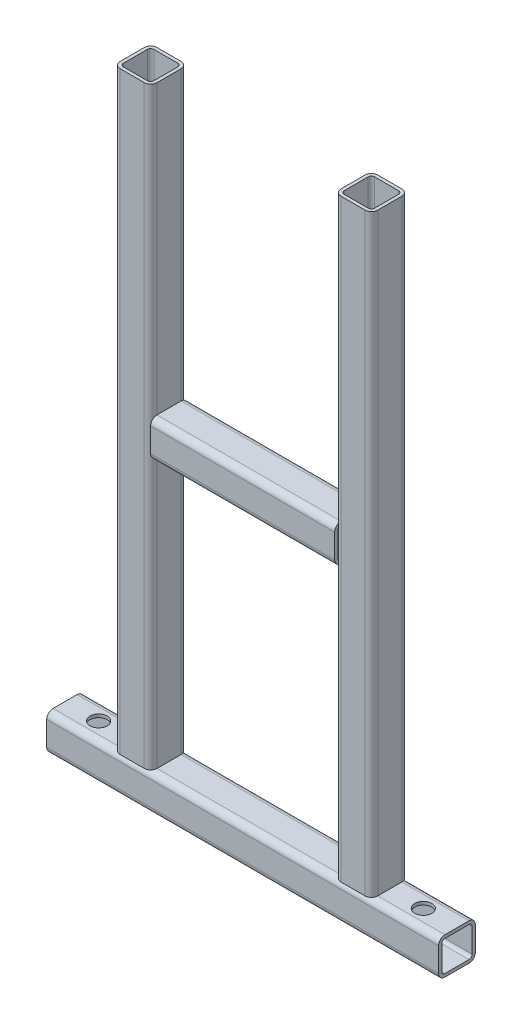
from build123d import *

# Parameters (mm, degrees)
SQUARE_TUBE_CONFIGURED_30_X_30_X_2_6_1_DEPTH = 501
SQUARE_TUBE_CONFIGURED_30_X_30_X_2_3_DEPTH   = 501
SQUARE_TUBE_CONFIGURED_30_X_30_X_2_4_DEPTH   = 320
SQUARE_TUBE_CONFIGURED_30_X_30_X_2_5_DEPTH   = 182.26
IZIM9_W                                      = 7
IZIM9_H                                      = 30


with BuildPart() as part:
    # Sketch1 → Square tube - configured 30 X 30 X 2.6(1) (new body)
    with BuildSketch(Plane(origin=(-90.13, 0, 0), x_dir=(1, 0, 0), z_dir=(0, -1, 0))):
        with BuildLine():
            Line((-9.8, -15), (9.8, -15))
            ThreePointArc((9.8, -15), (13.476955262, -13.476955262), (15, -9.8))
            Line((15, -9.8), (15, 9.8))
            ThreePointArc((15, 9.8), (13.476955262, 13.476955262), (9.8, 15))
            Line((9.8, 15), (-9.8, 15))
            ThreePointArc((-9.8, 15), (-13.476955262, 13.476955262), (-15, 9.8))
            Line((-15, 9.8), (-15, -9.8))
            ThreePointArc((-15, -9.8), (-13.476955262, -13.476955262), (-9.8, -15))
        make_face()
        with BuildLine():
            Line((-9.8, -12.4), (9.8, -12.4))
            ThreePointArc((9.8, -12.4), (11.638477631, -11.638477631), (12.4, -9.8))
            Line((12.4, -9.8), (12.4, 9.8))
            ThreePointArc((12.4, 9.8), (11.638477631, 11.638477631), (9.8, 12.4))
            Line((9.8, 12.4), (-9.8, 12.4))
            ThreePointArc((-9.8, 12.4), (-11.638477631, 11.638477631), (-12.4, 9.8))
            Line((-12.4, 9.8), (-12.4, -9.8))
            ThreePointArc((-12.4, -9.8), (-11.638477631, -11.638477631), (-9.8, -12.4))
        make_face(mode=Mode.SUBTRACT)
    extrude(amount=SQUARE_TUBE_CONFIGURED_30_X_30_X_2_6_1_DEPTH)

    # Square tube - configured 30 X 30 X 2 2
    split(bisect_by=Plane(origin=(-90.13, -485, 0), x_dir=(-1, 0, 0), z_dir=(0, 1, 0)), keep=Keep.TOP)


with BuildPart() as body_2:
    # Sketch1 on segment 2 (carried to segment 2) → Square tube - configured 30 X 30 X 2 3 (new body)
    with BuildSketch(Plane(origin=(90.13, 0, 0), x_dir=(1, 0, 0), z_dir=(0, -1, 0))):
        with BuildLine():
            Line((-9.8, -15), (9.8, -15))
            ThreePointArc((9.8, -15), (13.476955262, -13.476955262), (15, -9.8))
            Line((15, -9.8), (15, 9.8))
            ThreePointArc((15, 9.8), (13.476955262, 13.476955262), (9.8, 15))
            Line((9.8, 15), (-9.8, 15))
            ThreePointArc((-9.8, 15), (-13.476955262, 13.476955262), (-15, 9.8))
            Line((-15, 9.8), (-15, -9.8))
            ThreePointArc((-15, -9.8), (-13.476955262, -13.476955262), (-9.8, -15))
        make_face()
        with BuildLine():
            Line((-9.8, -12.4), (9.8, -12.4))
            ThreePointArc((9.8, -12.4), (11.638477631, -11.638477631), (12.4, -9.8))
            Line((12.4, -9.8), (12.4, 9.8))
            ThreePointArc((12.4, 9.8), (11.638477631, 11.638477631), (9.8, 12.4))
            Line((9.8, 12.4), (-9.8, 12.4))
            ThreePointArc((-9.8, 12.4), (-11.638477631, 11.638477631), (-12.4, 9.8))
            Line((-12.4, 9.8), (-12.4, -9.8))
            ThreePointArc((-12.4, -9.8), (-11.638477631, -11.638477631), (-9.8, -12.4))
        make_face(mode=Mode.SUBTRACT)
    extrude(amount=SQUARE_TUBE_CONFIGURED_30_X_30_X_2_3_DEPTH)

    # Square tube - configured 30 X 30 X 2 3 e
    split(bisect_by=Plane(origin=(90.13, -485, 0), x_dir=(-1, 0, 0), z_dir=(0, 1, 0)), keep=Keep.TOP)


with BuildPart() as body_3:
    # Sketch1 on segment 3 (carried to segment 3) → Square tube - configured 30 X 30 X 2 4 (new body)
    with BuildSketch(Plane(origin=(-160, -500, 0), x_dir=(0, 1, 0), z_dir=(1, 0, 0))):
        with BuildLine():
            Line((-9.8, -15), (9.8, -15))
            ThreePointArc((9.8, -15), (13.476955262, -13.476955262), (15, -9.8))
            Line((15, -9.8), (15, 9.8))
            ThreePointArc((15, 9.8), (13.476955262, 13.476955262), (9.8, 15))
            Line((9.8, 15), (-9.8, 15))
            ThreePointArc((-9.8, 15), (-13.476955262, 13.476955262), (-15, 9.8))
            Line((-15, 9.8), (-15, -9.8))
            ThreePointArc((-15, -9.8), (-13.476955262, -13.476955262), (-9.8, -15))
        make_face()
        with BuildLine():
            Line((-9.8, -12.4), (9.8, -12.4))
            ThreePointArc((9.8, -12.4), (11.638477631, -11.638477631), (12.4, -9.8))
            Line((12.4, -9.8), (12.4, 9.8))
            ThreePointArc((12.4, 9.8), (11.638477631, 11.638477631), (9.8, 12.4))
            Line((9.8, 12.4), (-9.8, 12.4))
            ThreePointArc((-9.8, 12.4), (-11.638477631, 11.638477631), (-12.4, 9.8))
            Line((-12.4, 9.8), (-12.4, -9.8))
            ThreePointArc((-12.4, -9.8), (-11.638477631, -11.638477631), (-9.8, -12.4))
        make_face(mode=Mode.SUBTRACT)
    extrude(amount=SQUARE_TUBE_CONFIGURED_30_X_30_X_2_4_DEPTH)

    # Çizim9 → M16 Dişli Delik1 (revolve, cut)
    with BuildSketch(Plane(origin=(-132.565, -485, 0), x_dir=(0, 0, 1), z_dir=(1, 0, 0))):
        with Locations((3.5, 15)):
            Rectangle(IZIM9_W, IZIM9_H)
    m16_di_li_delik1 = revolve(axis=Axis((-132.565, -478.65, 0), (0, -1, 0)), mode=Mode.SUBTRACT)

    # Aynalama1: M16 Dişli Delik1 across plane
    add(m16_di_li_delik1.mirror(Plane(origin=(0, 0, 0), x_dir=(0, 0, 1), z_dir=(1, 0, 0))), mode=Mode.SUBTRACT)


with BuildPart() as body_4:
    # Sketch1 on segment 4 (carried to segment 4) → Square tube - configured 30 X 30 X 2 5 (new body)
    with BuildSketch(Plane(origin=(-91.13, -250, 0), x_dir=(0, 1, 0), z_dir=(1, 0, 0))):
        with BuildLine():
            Line((-9.8, -15), (9.8, -15))
            ThreePointArc((9.8, -15), (13.476955262, -13.476955262), (15, -9.8))
            Line((15, -9.8), (15, 9.8))
            ThreePointArc((15, 9.8), (13.476955262, 13.476955262), (9.8, 15))
            Line((9.8, 15), (-9.8, 15))
            ThreePointArc((-9.8, 15), (-13.476955262, 13.476955262), (-15, 9.8))
            Line((-15, 9.8), (-15, -9.8))
            ThreePointArc((-15, -9.8), (-13.476955262, -13.476955262), (-9.8, -15))
        make_face()
        with BuildLine():
            Line((-9.8, -12.4), (9.8, -12.4))
            ThreePointArc((9.8, -12.4), (11.638477631, -11.638477631), (12.4, -9.8))
            Line((12.4, -9.8), (12.4, 9.8))
            ThreePointArc((12.4, 9.8), (11.638477631, 11.638477631), (9.8, 12.4))
            Line((9.8, 12.4), (-9.8, 12.4))
            ThreePointArc((-9.8, 12.4), (-11.638477631, 11.638477631), (-12.4, 9.8))
            Line((-12.4, 9.8), (-12.4, -9.8))
            ThreePointArc((-12.4, -9.8), (-11.638477631, -11.638477631), (-9.8, -12.4))
        make_face(mode=Mode.SUBTRACT)
    extrude(amount=SQUARE_TUBE_CONFIGURED_30_X_30_X_2_5_DEPTH)

    # Square tube - configured 30 X 30 X 2 5 e
    split(bisect_by=Plane(origin=(-75.13, -250, 0), x_dir=(0, 1, 0), z_dir=(1, 0, 0)), keep=Keep.TOP)

    # Square tube - configured 30 X 30 X 2 6
    split(bisect_by=Plane(origin=(75.13, -250, 0), x_dir=(0, -1, 0), z_dir=(-1, 0, 0)), keep=Keep.TOP)


solid = Compound([part.part, body_2.part, body_3.part, body_4.part])
